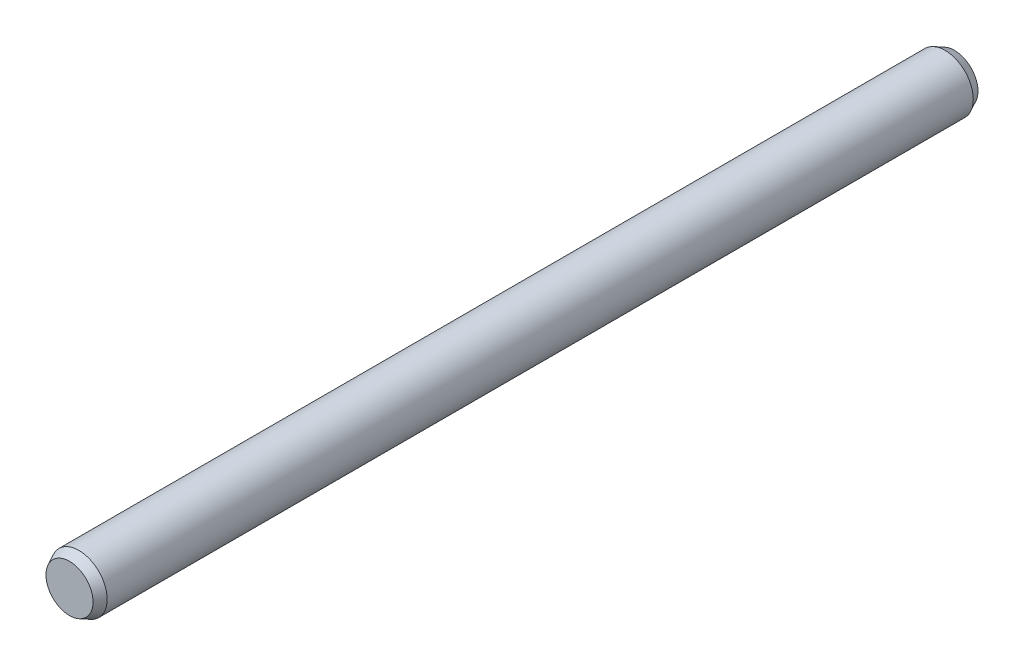
from build123d import *

# Parameters (mm, degrees)
SKETCH2_R           = 1.5
BOSS_EXTRUDE1_DEPTH = 47
CHAMFER1_SIZE       = 0.5
CHAMFER1_SIZE2      = 0.25
CHAMFER2_SIZE       = 0.25
CHAMFER2_SIZE2      = 0.5


with BuildPart() as part:
    # Sketch2 → Boss-Extrude1 (new body)
    with BuildSketch(Plane.XY):
        Circle(SKETCH2_R)
    extrude(amount=BOSS_EXTRUDE1_DEPTH)

    # Chamfer1
    chamfer1_edges = [part.edges().sort_by_distance(p)[0] for p in [
        (-1.5, 0, 47),
    ]]
    chamfer1_side = [part.faces().sort_by_distance(p)[0] for p in [
        (-1.5, 0, 23.5),
    ]]
    chamfer(chamfer1_edges, length=CHAMFER1_SIZE, length2=CHAMFER1_SIZE2, reference=chamfer1_side[0])

    # Chamfer2
    chamfer2_edges = [part.edges().sort_by_distance(p)[0] for p in [
        (-1.5, 0, 0),
    ]]
    chamfer2_side = [part.faces().sort_by_distance(p)[0] for p in [
        (0, 0, 0),
    ]]
    chamfer(chamfer2_edges, length=CHAMFER2_SIZE, length2=CHAMFER2_SIZE2, reference=chamfer2_side[0])


solid = part.part
